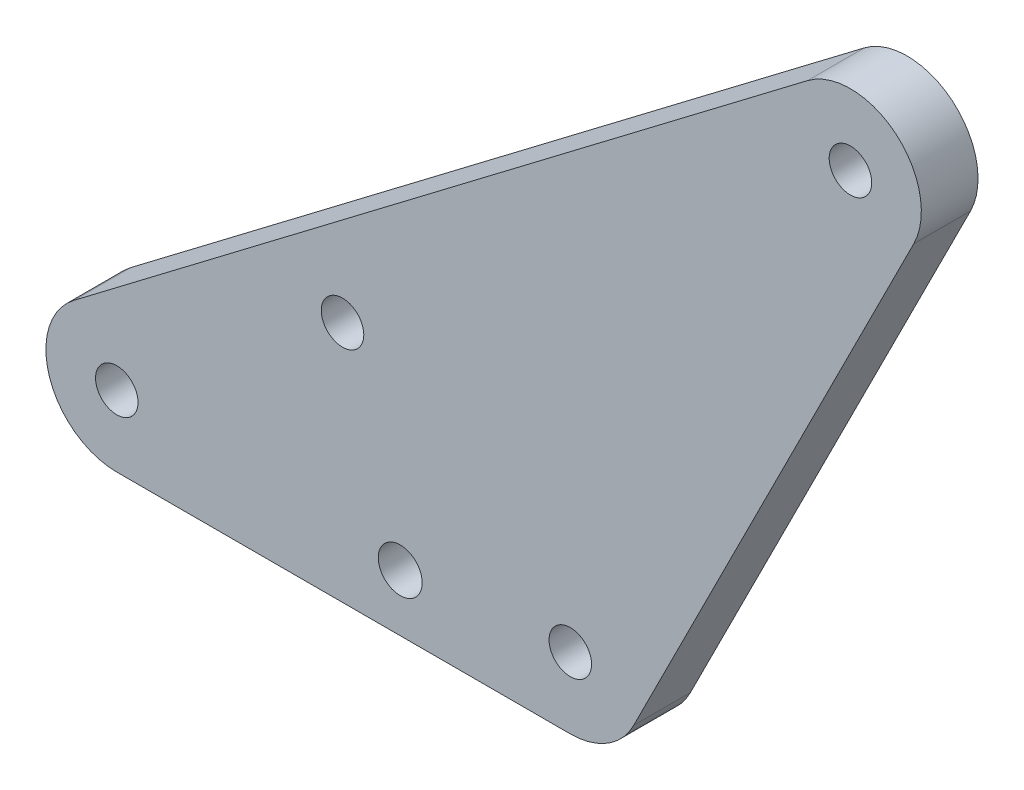
from build123d import *

# Parameters (mm, degrees)
SKETCH_1_R      = 1.5
SKETCH_1_R_2    = 1.55
EXTRUDE_1_DEPTH = 4


with BuildPart() as part:
    # 草图1 → 凸台-拉伸1 (new body)
    with BuildSketch(Plane.XY):
        with BuildLine():
            Line((12.826389613, 29.00362922), (-38.939235387, -10.306930028))
            ThreePointArc((-38.939235387, -10.306930028), (-40.654009304, -15.884229397), (-35.915346214, -19.288901182))
            Line((-35.915346214, -19.288901182), (-3.915346214, -19.288901182))
            ThreePointArc((-3.915346214, -19.288901182), (-1.291462523, -18.545100704), (0.551762792, -16.534994932))
            Line((0.551762792, -16.534994932), (20.317387792, 22.775564316))
            ThreePointArc((20.317387792, 22.775564316), (19.046826765, 28.866405264), (12.826389613, 29.00362922))
        make_face()
        with Locations((15.850278786, 25.021658066)):
            Circle(SKETCH_1_R, mode=Mode.SUBTRACT)
        with Locations((-3.915346214, -14.288901182)):
            Circle(SKETCH_1_R, mode=Mode.SUBTRACT)
        with Locations((-35.915346214, -14.288901182)):
            Circle(SKETCH_1_R, mode=Mode.SUBTRACT)
        with Locations((-19.987461598, -2.19334449)):
            Circle(SKETCH_1_R, mode=Mode.SUBTRACT)
        with Locations((-15.915346214, -15.288901182)):
            Circle(SKETCH_1_R_2, mode=Mode.SUBTRACT)
    extrude(amount=EXTRUDE_1_DEPTH)


solid = part.part
